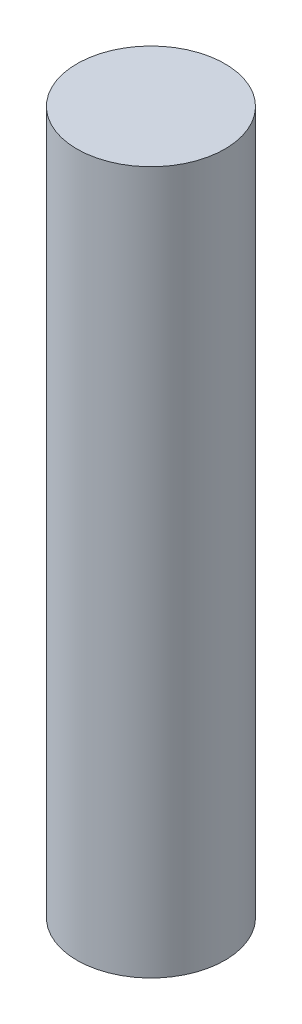
from build123d import *

# Parameters (mm, degrees)
SKETCH1_R           = 4
BOSS_EXTRUDE1_DEPTH = 19


with BuildPart() as part:
    # Sketch1 → Boss-Extrude1 (new, symmetric)
    with BuildSketch(Plane(origin=(0, 0, 0), x_dir=(1, 0, 0), z_dir=(0, 1, 0))):
        with Locations(Location((0, 0, 0), (0, 0, 270))):
            Circle(SKETCH1_R)
    extrude(amount=BOSS_EXTRUDE1_DEPTH, both=True)


solid = part.part
